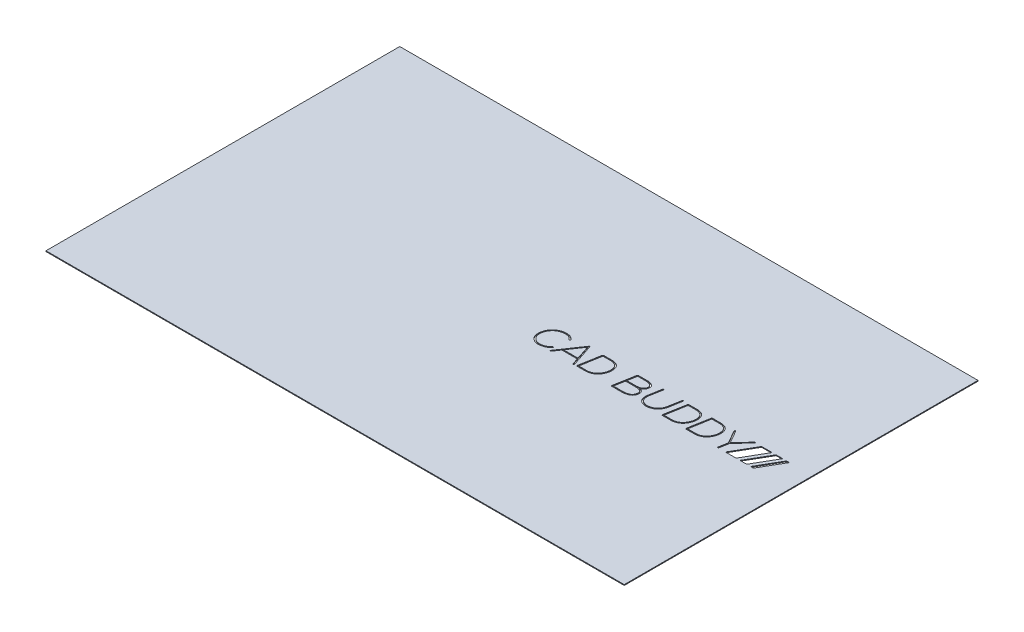
from build123d import *

# Parameters (mm, degrees)
SKETCH1_W           = 1030.522416643
SKETCH1_H           = 409.334235309
BOSS_EXTRUDE1_DEPTH = 2.54
CUT_EXTRUDE1_DEPTH  = 2.54


with BuildPart() as part:
    # Sketch1 → Boss-Extrude1 (new body)
    # profile 1 of 2: a face of its own
    with BuildSketch(Plane(origin=(0, 0, 0), x_dir=(1, 0, 0), z_dir=(0, 1, 0))):
        with Locations((439.348755368, 37.716505685)):
            Rectangle(SKETCH1_W, SKETCH1_H)
        Polygon((878.697510735, 75.43301137), (869.172510735, 75.43301137), (825.621241315, 0), (835.146241315, 0), align=None, mode=Mode.SUBTRACT)
        Polygon((821.547510735, 75.43301137), (777.996241315, 0), (743.071241315, 0), (786.622510735, 75.43301137), align=None, mode=Mode.SUBTRACT)
        Polygon((856.472510735, 75.43301137), (812.921241315, 0), (790.696241315, 0), (834.247510735, 75.43301137), align=None, mode=Mode.SUBTRACT)
    # profile 2 of 2: a face of its own
    with BuildSketch(Plane(origin=(0, 0, 0), x_dir=(1, 0, 0), z_dir=(0, 1, 0))):
        Polygon((-950.390036311, -544.981502598), (954.609963689, -544.981502598), (954.609963689, -166.950611969), (-75.912452954, -166.950611969), (-75.912452954, 242.38362334), (954.609963689, 242.38362334), (954.609963689, 620.414513968), (-950.390036311, 620.414513968), align=None)
    extrude(amount=BOSS_EXTRUDE1_DEPTH)

    # Sketch3 → Cut-Extrude1 (cut)
    # profile 1 of 8: a face of its own
    with BuildSketch(Plane(origin=(0, 2.54, 0), x_dir=(1, 0, 0), z_dir=(0, 1, 0))):
        with BuildLine():
            add(Edge.make_bspline(
                [(716.636620291, 2.243270089), (716.621022077, 1.905468599), (716.593763907, 1.315154195), (716.863305183, 0.515071012), (717.474198698, 0.012779762), (717.973277626, -0.006733088), (718.239527657, -0.017142857)],
                knots=[0, 0, 0, 0, 1.251005084, 2.186154716, 3.032344715, 4, 4, 4, 4], degree=3))
            add(Edge.make_bspline(
                [(718.239527657, -0.017142857), (718.490189121, 0.012230662), (719.018079174, 0.074090944), (719.750563496, 0.51682213), (720.38577985, 1.238901166), (720.562412186, 1.884208643), (720.656670514, 2.228571429)],
                knots=[0, 0, 0, 0, 0.842313664, 1.77390253, 2.812062229, 4, 4, 4, 4], degree=3))
            Line((720.656670514, 2.228571429), (725.763249755, 31.155636161))
            Line((725.763249755, 31.155636161), (764.999097969, 73.576238839))
            add(Edge.make_bspline(
                [(764.999097969, 73.576238839), (765.244884766, 73.862641095), (765.681277499, 74.371146291), (766.074464519, 75.193791072), (766.0898835, 75.981787228), (765.661809494, 76.568762835), (765.034149293, 76.956152137), (764.214130608, 76.940125235), (763.327309622, 76.591956196), (762.766676913, 76.176705724), (762.450956228, 75.942857143)],
                knots=[0, 0, 0, 0, 1.307658571, 2.321738624, 3.116123316, 3.903530844, 4.730968173, 5.584895801, 6.639932453, 8, 8, 8, 8], degree=3))
            Line((762.450956228, 75.942857143), (724.333863594, 34.473448661))
            Line((724.333863594, 34.473448661), (700.719611362, 75.946104911))
            add(Edge.make_bspline(
                [(700.719611362, 75.946104911), (700.487822454, 76.180059219), (700.067343928, 76.604465905), (699.277973236, 76.954797433), (698.463380944, 76.939421812), (697.756735661, 76.557575578), (697.166634268, 76.014683784), (696.891276908, 75.256274436), (696.942143315, 74.399062263), (697.189892226, 73.856442825), (697.325241942, 73.56)],
                knots=[0, 0, 0, 0, 1.181218228, 2.142798388, 3.030039168, 4.017166943, 4.979852749, 5.861078268, 6.831468325, 8, 8, 8, 8], degree=3))
            Line((697.325241942, 73.56), (721.734477434, 31.155636161))
            Line((721.734477434, 31.155636161), (716.636620291, 2.243270089))
        make_face()
    # profile 2 of 8: a face of its own
    with BuildSketch(Plane(origin=(0, 2.54, 0), x_dir=(1, 0, 0), z_dir=(0, 1, 0))):
        with BuildLine():
            add(Edge.make_bspline(
                [(640.88583346, 0.30359933), (641.842722985, 0.369851971), (643.736667725, 0.500983973), (646.525323889, 0.863769693), (649.22190943, 1.356618161), (651.812134214, 1.995790287), (654.310962107, 2.746460241), (656.706845669, 3.641019222), (659.013956052, 4.648086093), (661.215705386, 5.805248345), (663.320688632, 7.083112773), (665.316389088, 8.503389777), (667.235026432, 10.029350108), (669.035944189, 11.705690169), (670.755619681, 13.50259076), (672.354789306, 15.44451417), (673.889110265, 17.492753904), (675.733014147, 20.385806758), (677.784409253, 24.079143747), (679.796737798, 28.594313424), (681.346510948, 33.105001718), (682.381865404, 37.627651796), (682.935952512, 42.149310024), (683.0038995, 46.677509454), (682.59490101, 51.201947163), (681.834372882, 54.924856029), (681.009481486, 57.829851086), (680.217790963, 59.894900038), (679.278163293, 61.825391043), (678.201436812, 63.632577396), (676.995412987, 65.316233832), (675.605776072, 66.845765195), (674.091583347, 68.255589976), (672.449616506, 69.55061614), (670.638542865, 70.678611438), (668.70881834, 71.720832864), (666.603427832, 72.580949439), (664.370612873, 73.336575873), (661.995910167, 73.974824651), (659.475081119, 74.465389333), (656.812731076, 74.825322278), (654.989004251, 74.963596534), (654.056670514, 75.034285714)],
                knots=[0, 0, 0, 0, 0.999295175, 1.977877061, 2.928525191, 3.854231462, 4.756488502, 5.645743385, 6.517543425, 7.377798646, 8.235598142, 9.081452247, 9.928604735, 10.788179659, 11.643143241, 12.518352726, 13.407946438, 14.308079036, 16.091098334, 17.805063943, 19.452657269, 21.053083911, 22.630629005, 24.19085238, 25.763355152, 27.354996138, 28.142638538, 28.907860309, 29.656169272, 30.377113826, 31.097689454, 31.81024964, 32.526457578, 33.251839058, 33.985265051, 34.747073797, 35.534423556, 36.351625181, 37.202348423, 38.09450905, 39.025866443, 40, 40, 40, 40], degree=3))
            add(Edge.make_bspline(
                [(654.056670514, 75.034285714), (652.810956228, 75.034285714), (650.388099085, 75.034285714), (646.845241942, 75.034285714), (643.496670514, 75.034285714), (640.273813371, 75.034285714), (637.056670514, 75.034285714), (633.719527657, 75.034285714), (630.199527657, 75.034285714), (627.793813371, 75.034285714), (626.559527657, 75.034285714)],
                knots=[0, 0, 0, 0, 1.087281796, 2.114713217, 3.092269327, 4.009975062, 4.927680798, 5.900249377, 6.922693267, 8, 8, 8, 8], degree=3))
            add(Edge.make_bspline(
                [(626.559527657, 75.034285714), (626.122390391, 74.98936814), (625.253505794, 74.900086827), (624.116321367, 74.251931782), (623.213224985, 73.31755122), (622.975458552, 72.507539002), (622.856670514, 72.102857143)],
                knots=[0, 0, 0, 0, 1.025104092, 2.037568578, 3.019569853, 4, 4, 4, 4], degree=3))
            Line((622.856670514, 72.102857143), (610.734828996, 3.359179688))
            add(Edge.make_bspline(
                [(610.734828996, 3.359179688), (610.70653514, 3.147895225), (610.653517572, 2.75198637), (610.757048519, 2.175922834), (610.93684067, 1.644914036), (611.26990732, 1.188383686), (611.687185592, 0.809474861), (612.174206496, 0.502487668), (612.76072632, 0.334282345), (613.175690416, 0.306193353), (613.393813371, 0.291428571)],
                knots=[0, 0, 0, 0, 1.08844057, 2.039540695, 2.977861543, 3.947370317, 4.903444139, 5.865362813, 6.877942992, 8, 8, 8, 8], degree=3))
            add(Edge.make_bspline(
                [(613.393813371, 0.291428571), (614.6223848, 0.291428571), (617.0223848, 0.291428571), (620.536670514, 0.291428571), (623.873813371, 0.291428571), (627.090956228, 0.291428571), (630.313813371, 0.291428571), (633.6623848, 0.291428571), (637.205241942, 0.291428571), (639.628099085, 0.291428571), (640.873813371, 0.291428571)],
                knots=[0, 0, 0, 0, 1.072988147, 2.096069869, 3.069245165, 3.987523394, 4.905801622, 5.883967561, 6.912039925, 8, 8, 8, 8], degree=3))
            Line((640.873813371, 0.291428571), (640.88583346, 0.30359933))
        make_face()
        with BuildLine():
            add(Edge.make_bspline(
                [(626.663673862, 71.522159598), (627.863244115, 71.521242131), (630.205671249, 71.519450572), (633.628099126, 71.52013563), (636.873813361, 71.519966624), (639.999527659, 71.520008717), (643.136670513, 71.519997495), (646.399527657, 71.520000725), (649.856670514, 71.519999802), (652.2223848, 71.519999933), (653.439527657, 71.52)],
                knots=[0, 0, 0, 0, 1.07521098, 2.099588054, 3.067624389, 3.98444187, 4.901259351, 5.879539457, 6.909038416, 8, 8, 8, 8], degree=3))
            add(Edge.make_bspline(
                [(653.439527657, 71.52), (654.268877473, 71.453577186), (655.891802533, 71.323596753), (658.25687519, 71.000763752), (660.49068907, 70.558118708), (662.593108597, 69.991797465), (664.570074547, 69.305839649), (666.425952286, 68.506199309), (668.144451906, 67.570335098), (669.749764494, 66.548875642), (671.213607669, 65.38825481), (672.558477941, 64.121578211), (673.76114752, 62.71935748), (674.849395331, 61.210436461), (675.784496599, 59.571258057), (676.623027854, 57.830597557), (677.295932956, 55.958811984), (678.04456016, 53.335606005), (678.686878401, 49.965802785), (679.053535003, 45.876839092), (678.9915862, 41.783360149), (678.457402455, 37.696868846), (677.53722015, 33.608569235), (676.136517259, 29.533088236), (674.354687247, 25.441795923), (672.520991657, 22.094027862), (670.843838156, 19.49610778), (669.521488918, 17.614041657), (668.06271473, 15.890197469), (666.561201682, 14.244707268), (664.94386731, 12.740121926), (663.244650397, 11.346721903), (661.457165703, 10.075996703), (659.584947799, 8.923676331), (657.62157406, 7.897507678), (655.581951944, 6.966796469), (653.450923998, 6.161989555), (651.235236889, 5.475948853), (648.933771651, 4.911082018), (646.54155205, 4.464727433), (644.062662992, 4.142331108), (642.377366346, 4.009845093), (641.525241942, 3.942857143)],
                knots=[0, 0, 0, 0, 0.967011303, 1.892309911, 2.772922942, 3.612418362, 4.421183526, 5.203550084, 5.958449525, 6.693598579, 7.412513827, 8.126687773, 8.837797046, 9.556681607, 10.28583451, 11.028626024, 11.799859975, 12.594564328, 14.198191793, 15.778608685, 17.359723364, 18.946534416, 20.561129796, 22.222646425, 23.947881401, 25.743407272, 26.651766224, 27.542070986, 28.41465597, 29.274814831, 30.130112619, 30.979768914, 31.827605759, 32.677469744, 33.53318012, 34.401202405, 35.28204087, 36.179158533, 37.095833927, 38.035140818, 39.006522405, 40, 40, 40, 40], degree=3))
            add(Edge.make_bspline(
                [(641.525241942, 3.942857143), (640.308099085, 3.942857143), (637.9423848, 3.942857143), (634.485241942, 3.942857143), (631.2223848, 3.942857143), (628.085241942, 3.942857143), (624.959527657, 3.942857143), (621.713813371, 3.942857143), (618.290956228, 3.942857143), (615.948099085, 3.942857143), (614.748099085, 3.942857143)],
                knots=[0, 0, 0, 0, 1.090909091, 2.120358515, 3.098591549, 4.015364917, 4.932138284, 5.900128041, 6.924455826, 8, 8, 8, 8], degree=3))
            Line((614.748099085, 3.942857143), (626.663673862, 71.522159598))
        make_face(mode=Mode.SUBTRACT)
    # profile 3 of 8: a face of its own
    with BuildSketch(Plane(origin=(0, 2.54, 0), x_dir=(1, 0, 0), z_dir=(0, 1, 0))):
        with BuildLine():
            add(Edge.make_bspline(
                [(562.988690603, 0.30359933), (563.945580128, 0.369851971), (565.839524868, 0.500983973), (568.628181031, 0.863769693), (571.324766573, 1.356618161), (573.914991357, 1.995790287), (576.41381925, 2.746460241), (578.809702812, 3.641019222), (581.116813195, 4.648086093), (583.318562529, 5.805248345), (585.423545774, 7.083112773), (587.419246231, 8.503389777), (589.337883575, 10.029350108), (591.138801332, 11.705690169), (592.858476824, 13.50259076), (594.457646449, 15.44451417), (595.991967408, 17.492753904), (597.835871289, 20.385806758), (599.887266396, 24.079143747), (601.899594941, 28.594313424), (603.449368091, 33.105001718), (604.484722547, 37.627651796), (605.038809655, 42.149310024), (605.106756643, 46.677509454), (604.697758152, 51.201947163), (603.937230025, 54.924856029), (603.112338629, 57.829851086), (602.320648106, 59.894900038), (601.381020436, 61.825391043), (600.304293955, 63.632577396), (599.098270129, 65.316233832), (597.708633215, 66.845765195), (596.19444049, 68.255589976), (594.552473649, 69.55061614), (592.741400008, 70.678611438), (590.811675483, 71.720832864), (588.706284975, 72.580949439), (586.473470016, 73.336575873), (584.09876731, 73.974824651), (581.577938262, 74.465389333), (578.915588218, 74.825322278), (577.091861394, 74.963596534), (576.159527657, 75.034285714)],
                knots=[0, 0, 0, 0, 0.999295175, 1.977877061, 2.928525191, 3.854231462, 4.756488502, 5.645743385, 6.517543425, 7.377798646, 8.235598142, 9.081452247, 9.928604735, 10.788179659, 11.643143241, 12.518352726, 13.407946438, 14.308079036, 16.091098334, 17.805063943, 19.452657269, 21.053083911, 22.630629005, 24.19085238, 25.763355152, 27.354996138, 28.142638538, 28.907860309, 29.656169272, 30.377113826, 31.097689454, 31.81024964, 32.526457578, 33.251839058, 33.985265051, 34.747073797, 35.534423556, 36.351625181, 37.202348423, 38.09450905, 39.025866443, 40, 40, 40, 40], degree=3))
            add(Edge.make_bspline(
                [(576.159527657, 75.034285714), (574.913813371, 75.034285714), (572.490956228, 75.034285714), (568.948099085, 75.034285714), (565.599527657, 75.034285714), (562.376670514, 75.034285714), (559.159527657, 75.034285714), (555.8223848, 75.034285714), (552.3023848, 75.034285714), (549.896670514, 75.034285714), (548.6623848, 75.034285714)],
                knots=[0, 0, 0, 0, 1.087281796, 2.114713217, 3.092269327, 4.009975062, 4.927680798, 5.900249377, 6.922693267, 8, 8, 8, 8], degree=3))
            add(Edge.make_bspline(
                [(548.6623848, 75.034285714), (548.225247534, 74.98936814), (547.356362937, 74.900086827), (546.21917851, 74.251931782), (545.316082128, 73.31755122), (545.078315695, 72.507539002), (544.959527657, 72.102857143)],
                knots=[0, 0, 0, 0, 1.025104092, 2.037568578, 3.019569853, 4, 4, 4, 4], degree=3))
            Line((544.959527657, 72.102857143), (532.837686139, 3.359179688))
            add(Edge.make_bspline(
                [(532.837686139, 3.359179688), (532.809392283, 3.147895225), (532.756374715, 2.75198637), (532.859905661, 2.175922834), (533.039697813, 1.644914036), (533.372764462, 1.188383686), (533.790042735, 0.809474861), (534.277063639, 0.502487668), (534.863583463, 0.334282345), (535.278547559, 0.306193353), (535.496670514, 0.291428571)],
                knots=[0, 0, 0, 0, 1.08844057, 2.039540695, 2.977861543, 3.947370317, 4.903444139, 5.865362813, 6.877942992, 8, 8, 8, 8], degree=3))
            add(Edge.make_bspline(
                [(535.496670514, 0.291428571), (536.725241942, 0.291428571), (539.125241942, 0.291428571), (542.639527657, 0.291428571), (545.976670514, 0.291428571), (549.193813371, 0.291428571), (552.416670514, 0.291428571), (555.765241942, 0.291428571), (559.308099085, 0.291428571), (561.730956228, 0.291428571), (562.976670514, 0.291428571)],
                knots=[0, 0, 0, 0, 1.072988147, 2.096069869, 3.069245165, 3.987523394, 4.905801622, 5.883967561, 6.912039925, 8, 8, 8, 8], degree=3))
            Line((562.976670514, 0.291428571), (562.988690603, 0.30359933))
        make_face()
        with BuildLine():
            add(Edge.make_bspline(
                [(548.766531005, 71.522159598), (549.966101258, 71.521242131), (552.308528392, 71.519450572), (555.730956269, 71.52013563), (558.976670504, 71.519966624), (562.102384802, 71.520008717), (565.239527656, 71.519997495), (568.5023848, 71.520000725), (571.959527657, 71.519999802), (574.325241942, 71.519999933), (575.5423848, 71.52)],
                knots=[0, 0, 0, 0, 1.07521098, 2.099588054, 3.067624389, 3.98444187, 4.901259351, 5.879539457, 6.909038416, 8, 8, 8, 8], degree=3))
            add(Edge.make_bspline(
                [(575.5423848, 71.52), (576.371734616, 71.453577186), (577.994659676, 71.323596753), (580.359732332, 71.000763752), (582.593546212, 70.558118708), (584.69596574, 69.991797465), (586.67293169, 69.305839649), (588.528809429, 68.506199309), (590.247309049, 67.570335098), (591.852621637, 66.548875642), (593.316464812, 65.38825481), (594.661335084, 64.121578211), (595.864004663, 62.71935748), (596.952252474, 61.210436461), (597.887353742, 59.571258057), (598.725884997, 57.830597557), (599.398790099, 55.958811984), (600.147417303, 53.335606005), (600.789735544, 49.965802785), (601.156392146, 45.876839092), (601.094443343, 41.783360149), (600.560259598, 37.696868846), (599.640077292, 33.608569235), (598.239374402, 29.533088236), (596.457544389, 25.441795923), (594.6238488, 22.094027862), (592.946695299, 19.49610778), (591.624346061, 17.614041657), (590.165571872, 15.890197469), (588.664058825, 14.244707268), (587.046724452, 12.740121926), (585.34750754, 11.346721903), (583.560022846, 10.075996703), (581.687804942, 8.923676331), (579.724431203, 7.897507678), (577.684809086, 6.966796469), (575.553781141, 6.161989555), (573.338094032, 5.475948853), (571.036628794, 4.911082018), (568.644409192, 4.464727433), (566.165520135, 4.142331108), (564.480223489, 4.009845093), (563.628099085, 3.942857143)],
                knots=[0, 0, 0, 0, 0.967011303, 1.892309911, 2.772922942, 3.612418362, 4.421183526, 5.203550084, 5.958449525, 6.693598579, 7.412513827, 8.126687773, 8.837797046, 9.556681607, 10.28583451, 11.028626024, 11.799859975, 12.594564328, 14.198191793, 15.778608685, 17.359723364, 18.946534416, 20.561129796, 22.222646425, 23.947881401, 25.743407272, 26.651766224, 27.542070986, 28.41465597, 29.274814831, 30.130112619, 30.979768914, 31.827605759, 32.677469744, 33.53318012, 34.401202405, 35.28204087, 36.179158533, 37.095833927, 38.035140818, 39.006522405, 40, 40, 40, 40], degree=3))
            add(Edge.make_bspline(
                [(563.628099085, 3.942857143), (562.410956228, 3.942857143), (560.045241942, 3.942857143), (556.588099085, 3.942857143), (553.325241942, 3.942857143), (550.188099085, 3.942857143), (547.0623848, 3.942857143), (543.816670514, 3.942857143), (540.393813371, 3.942857143), (538.050956228, 3.942857143), (536.850956228, 3.942857143)],
                knots=[0, 0, 0, 0, 1.090909091, 2.120358515, 3.098591549, 4.015364917, 4.932138284, 5.900128041, 6.924455826, 8, 8, 8, 8], degree=3))
            Line((536.850956228, 3.942857143), (548.766531005, 71.522159598))
        make_face(mode=Mode.SUBTRACT)
    # profile 4 of 8: a face of its own
    with BuildSketch(Plane(origin=(0, 2.54, 0), x_dir=(1, 0, 0), z_dir=(0, 1, 0))):
        with BuildLine():
            add(Edge.make_bspline(
                [(517.30692721, 33.720652902), (517.104105367, 32.901023975), (516.704551372, 31.28637534), (515.973086569, 28.94041609), (515.195516252, 26.684079985), (514.303334595, 24.54517217), (513.318304826, 22.511390134), (512.260963494, 20.572934615), (511.111137706, 18.744972681), (509.895353804, 17.005318489), (508.544088953, 15.408395078), (507.151294004, 13.872072092), (505.648508651, 12.46496889), (504.069052664, 11.158586268), (502.399525137, 9.951775081), (500.639906065, 8.859655007), (498.786519264, 7.876769584), (496.245870081, 6.710974426), (493.031200316, 5.523184343), (489.187257939, 4.448356777), (485.404011032, 3.831617132), (481.691148449, 3.615873862), (478.055878523, 3.821072506), (474.486093066, 4.439785851), (470.999481738, 5.501214589), (468.175924153, 6.69287276), (466.040179004, 7.875071574), (464.531510477, 8.849693832), (463.160898467, 9.954280333), (461.901769978, 11.151384611), (460.784170221, 12.466808256), (459.779446131, 13.880119875), (458.912965656, 15.407180054), (458.153525319, 17.028126367), (457.511892541, 18.751117294), (457.024183979, 20.590477315), (456.648574109, 22.526641688), (456.391011723, 24.565292251), (456.258957341, 26.706448909), (456.239677774, 28.955735344), (456.363691057, 31.307584615), (456.534832303, 32.903540397), (456.6223848, 33.72)],
                knots=[0, 0, 0, 0, 1.052607355, 2.073610355, 3.062893337, 4.027544296, 4.961279858, 5.879664996, 6.779199292, 7.653053879, 8.523386429, 9.385660849, 10.237509641, 11.087777591, 11.940103041, 12.804142008, 13.667975297, 14.554290253, 16.288073003, 17.935380479, 19.523786526, 21.058102051, 22.563961658, 24.054010431, 25.564330607, 27.099638489, 27.865065386, 28.606161103, 29.336144068, 30.056782474, 30.769344261, 31.48499867, 32.215885209, 32.955403614, 33.715138288, 34.505046732, 35.325318782, 36.172865581, 37.065345485, 37.998781952, 38.976216188, 40, 40, 40, 40], degree=3))
            add(Edge.make_bspline(
                [(456.6223848, 33.72), (457.241626142, 37.199630033), (458.463637605, 44.066335306), (460.252946102, 54.333090476), (462.071732005, 64.594655459), (463.290889612, 71.468583637), (463.908099085, 74.948571429)],
                knots=[0, 0, 0, 0, 1.01299813, 1.999051489, 2.98700187, 4, 4, 4, 4], degree=3))
            add(Edge.make_bspline(
                [(463.908099085, 74.948571429), (463.914023557, 75.23668037), (463.92465687, 75.753781697), (463.627818028, 76.444468823), (463.048348522, 76.84847536), (462.338837158, 76.952452934), (461.596642761, 76.87092391), (460.932714907, 76.495651764), (460.412226467, 75.87887826), (460.233039611, 75.351956841), (460.136670514, 75.068571429)],
                knots=[0, 0, 0, 0, 1.142497997, 2.050568878, 2.86724363, 3.842442552, 4.855323895, 5.794653566, 6.813935082, 8, 8, 8, 8], degree=3))
            add(Edge.make_bspline(
                [(460.136670514, 75.068571429), (459.521884136, 71.565297632), (458.309189601, 64.654928201), (456.459858749, 54.357756879), (454.678248413, 44.071489605), (453.453792889, 37.199499894), (452.833813371, 33.72)],
                knots=[0, 0, 0, 0, 1.016507693, 2.005108393, 2.989924981, 4, 4, 4, 4], degree=3))
            add(Edge.make_bspline(
                [(452.833813371, 33.72), (452.731004282, 32.795162967), (452.530835885, 30.994513345), (452.427055502, 28.338406932), (452.406145618, 25.803071916), (452.575347569, 23.377620326), (452.829449376, 21.066076305), (453.266630702, 18.879312493), (453.826701621, 16.80650228), (454.547933317, 14.860414654), (455.393639339, 13.024886411), (456.367038913, 11.300860956), (457.505839784, 9.704386806), (458.778891975, 8.223191742), (460.190555414, 6.862235346), (461.746918654, 5.627832539), (463.422640245, 4.487023818), (465.851141435, 3.183480941), (469.017546239, 1.824395678), (472.942653895, 0.625099626), (476.960843792, -0.0784155), (481.05688844, -0.323340972), (485.241592835, -0.065932019), (489.506288486, 0.637830065), (493.846009939, 1.845542179), (497.462860174, 3.200853515), (500.342648425, 4.490953656), (502.412978899, 5.639024418), (504.407923492, 6.858932652), (506.284185123, 8.228557766), (508.069519795, 9.706081922), (509.771582937, 11.291737837), (511.342669136, 13.02286347), (512.852099487, 14.838122), (514.226654938, 16.800996069), (515.539633364, 18.857961826), (516.742934073, 21.044796095), (517.832713729, 23.355649507), (518.828008374, 25.783864188), (519.734337462, 28.316913163), (520.550727684, 30.969028931), (520.991957401, 32.791723211), (521.216670514, 33.72)],
                knots=[0, 0, 0, 0, 1.027716656, 2.00095535, 2.935310908, 3.8272855, 4.685534274, 5.502699192, 6.288408952, 7.055405902, 7.792647579, 8.519325572, 9.239281043, 9.95554562, 10.674393041, 11.402030237, 12.147951809, 12.910780266, 14.44353951, 15.947423231, 17.434784648, 18.939926711, 20.470278768, 22.057207608, 23.706696919, 25.438693343, 26.320127344, 27.19027503, 28.052207839, 28.902079838, 29.754059601, 30.61158826, 31.469442207, 32.335181496, 33.218061287, 34.114804281, 35.030307274, 35.973514853, 36.936046979, 37.928507391, 38.945013144, 40, 40, 40, 40], degree=3))
            add(Edge.make_bspline(
                [(521.216670514, 33.72), (521.82697633, 37.200197901), (523.03266466, 44.075495301), (524.855337799, 54.353512673), (526.667422623, 64.657262173), (527.885023477, 71.565752821), (528.5023848, 75.068571429)],
                knots=[0, 0, 0, 0, 1.009863234, 1.995033118, 2.983419728, 4, 4, 4, 4], degree=3))
            add(Edge.make_bspline(
                [(528.5023848, 75.068571429), (528.501424762, 75.345293833), (528.499707058, 75.840406995), (528.196936434, 76.514049116), (527.588181578, 76.88015688), (526.853885438, 76.952192172), (526.093240082, 76.835077827), (525.400737536, 76.444401392), (524.870301554, 75.791291491), (524.679191408, 75.242806036), (524.576670514, 74.948571429)],
                knots=[0, 0, 0, 0, 1.079918528, 1.932195832, 2.759330193, 3.7327556, 4.779583398, 5.733447023, 6.784109368, 8, 8, 8, 8], degree=3))
            add(Edge.make_bspline(
                [(524.576670514, 74.948571429), (523.959461041, 71.468583637), (522.740303434, 64.594655459), (520.921517531, 54.333090476), (519.132209033, 44.066335306), (517.91019757, 37.199630033), (517.290956228, 33.72)],
                knots=[0, 0, 0, 0, 1.01299813, 2.000948511, 2.98700187, 4, 4, 4, 4], degree=3))
            Line((517.290956228, 33.72), (517.30692721, 33.720652902))
        make_face()
    # profile 5 of 8: a face of its own
    with BuildSketch(Plane(origin=(0, 2.54, 0), x_dir=(1, 0, 0), z_dir=(0, 1, 0))):
        with BuildLine():
            add(Edge.make_bspline(
                [(434.430102434, 21.457633929), (434.518595858, 22.11544764), (434.690228249, 23.391272844), (434.758405189, 25.269298229), (434.664321321, 27.038949632), (434.384324482, 28.697893125), (433.965377488, 30.250602725), (433.356915045, 31.690228489), (432.584083134, 33.015102564), (431.647165607, 34.222335234), (430.573490056, 35.319977988), (429.40000439, 36.328151278), (428.113340209, 37.224382856), (426.733391193, 38.034822151), (425.251627123, 38.754192309), (423.652179884, 39.351025694), (421.964853113, 39.869802217), (420.790284257, 40.122900112), (420.193813371, 40.251428571)],
                knots=[0, 0, 0, 0, 1.194510597, 2.316745149, 3.378288509, 4.379638158, 5.340691787, 6.267484065, 7.185093137, 8.09470723, 9.011508395, 9.945582237, 10.876136187, 11.830779774, 12.824754949, 13.837509919, 14.901841839, 16, 16, 16, 16], degree=3))
            add(Edge.make_bspline(
                [(420.193813371, 40.251428571), (421.16461254, 40.567593104), (423.057812838, 41.184160161), (425.651909806, 42.534136598), (427.99466983, 44.095858447), (430.017991843, 45.960062521), (431.750059466, 48.05053295), (433.112752803, 50.38917716), (434.167162409, 52.92491272), (434.563759868, 54.729125916), (434.765241942, 55.645714286)],
                knots=[0, 0, 0, 0, 1.092874696, 2.131265421, 3.123581607, 4.103547946, 5.069939407, 6.022897384, 6.995579199, 8, 8, 8, 8], degree=3))
            add(Edge.make_bspline(
                [(434.765241942, 55.645714286), (434.840826499, 56.57652824), (434.985091846, 58.353137162), (434.812296608, 60.926746849), (434.326985412, 63.258691636), (433.510314854, 65.35667543), (432.387036407, 67.225098346), (430.923296281, 68.839072866), (429.132943869, 70.196598148), (427.065308702, 71.271920918), (424.869944172, 72.157874016), (422.663474957, 72.957332946), (420.473672671, 73.62758933), (418.293166216, 74.160922045), (416.129492895, 74.557313698), (413.977040865, 74.816377973), (411.840959042, 74.938206522), (410.422488271, 74.922212148), (409.719527657, 74.914285714)],
                knots=[0, 0, 0, 0, 1.221510875, 2.331450994, 3.364637024, 4.328955469, 5.265737717, 6.203445891, 7.164245285, 8.191998032, 9.245309294, 10.263044025, 11.264278728, 12.242460943, 13.200838971, 14.142866002, 15.07964825, 16, 16, 16, 16], degree=3))
            Line((409.719527657, 74.914285714), (381.057005335, 74.93030692))
            add(Edge.make_bspline(
                [(381.057005335, 74.93030692), (380.747548989, 74.882488765), (380.159776345, 74.791664312), (379.400193854, 74.334664028), (378.831710616, 73.658318779), (378.638757587, 73.100724681), (378.536670514, 72.805714286)],
                knots=[0, 0, 0, 0, 1.056677754, 2.007023881, 2.94556152, 4, 4, 4, 4], degree=3))
            add(Edge.make_bspline(
                [(378.536670514, 72.805714286), (376.469729467, 61.051141183), (372.336650178, 37.546560494), (368.184013915, 14.045427121), (366.108099085, 2.297142857)],
                knots=[0, 0, 0, 0, 1.000194239, 2, 2, 2, 2], degree=3))
            add(Edge.make_bspline(
                [(366.108099085, 2.297142857), (366.100941903, 2.008117549), (366.087905493, 1.481674034), (366.422569895, 0.759918025), (367.070733764, 0.30359893), (367.59232294, 0.217756097), (367.873813371, 0.171428571)],
                knots=[0, 0, 0, 0, 1.09536942, 1.995154444, 2.918028084, 4, 4, 4, 4], degree=3))
            add(Edge.make_bspline(
                [(367.873813371, 0.171428571), (373.325241942, 0.171428571), (384.2223848, 0.171428571), (395.119527657, 0.171428571), (400.565241942, 0.171428571)],
                knots=[0, 0, 0, 0, 1.000524384, 2, 2, 2, 2], degree=3))
            add(Edge.make_bspline(
                [(400.565241942, 0.171428571), (401.508348512, 0.165996616), (403.379159679, 0.155221415), (406.166513192, 0.33549345), (408.90860957, 0.656429647), (411.597102753, 1.140285733), (414.237228975, 1.75692582), (416.829683038, 2.531623853), (419.379061412, 3.453708434), (421.862405369, 4.526191854), (424.23184258, 5.76270585), (426.382732453, 7.295834927), (428.306732736, 9.063268898), (430.003725473, 11.074998531), (431.466331371, 13.322587437), (432.7048094, 15.805834057), (433.701016758, 18.535754999), (434.177464615, 20.457719634), (434.4223848, 21.445714286)],
                knots=[0, 0, 0, 0, 1.033463853, 2.050050099, 3.059219513, 4.058073865, 5.042528709, 6.029391436, 7.022021109, 8.012217305, 8.992979244, 9.945330778, 10.898361732, 11.849476713, 12.822306886, 13.830679098, 14.884850736, 16, 16, 16, 16], degree=3))
            Line((434.4223848, 21.445714286), (434.430102434, 21.457633929))
        make_face()
        with BuildLine():
            add(Edge.make_bspline(
                [(409.110738594, 71.404637277), (410.269955397, 71.378055736), (412.639077529, 71.323730337), (416.255400805, 70.729703147), (419.972517047, 69.694953002), (423.095480578, 68.555976779), (425.517272572, 67.417601505), (427.059952393, 66.275104892), (428.362180166, 64.975387576), (429.384509094, 63.470545628), (430.108566776, 61.767641281), (430.572330866, 59.888349991), (430.75882262, 57.818877662), (430.665248563, 56.388355668), (430.616670514, 55.645714286)],
                knots=[0, 0, 0, 0, 1.363647557, 2.786922688, 4.299584316, 5.900146588, 6.697326205, 7.438656847, 8.147379583, 8.854472444, 9.565489818, 10.314320341, 11.124896034, 12, 12, 12, 12], degree=3))
            add(Edge.make_bspline(
                [(430.616670514, 55.645714286), (430.457540527, 54.996529876), (430.145957428, 53.725399934), (429.481378894, 51.919283539), (428.628477116, 50.271617565), (427.622711205, 48.769602661), (426.417404828, 47.437923872), (425.058209869, 46.246150219), (423.522228665, 45.216427686), (421.828260707, 44.348179944), (420.028124877, 43.607059597), (418.140250256, 42.974935639), (416.188384653, 42.41406424), (414.149852983, 42.005375756), (412.048848498, 41.644939699), (409.871899464, 41.435250441), (407.623972393, 41.308441681), (406.102566586, 41.312319171), (405.330956228, 41.314285714)],
                knots=[0, 0, 0, 0, 1.008756292, 1.975186567, 2.897471246, 3.804453989, 4.696540017, 5.601550699, 6.52766155, 7.480867571, 8.47111505, 9.464290153, 10.485916046, 11.535079697, 12.601765216, 13.703266585, 14.835167263, 16, 16, 16, 16], degree=3))
            Line((405.330956228, 41.314285714), (377.026508684, 41.31890625))
            Line((377.026508684, 41.31890625), (382.331251987, 71.404637277))
            Line((382.331251987, 71.404637277), (409.110738594, 71.404637277))
        make_face(mode=Mode.SUBTRACT)
        with BuildLine():
            Line((404.683311139, 37.558191964), (410.963456228, 37.558191964))
            add(Edge.make_bspline(
                [(410.963456228, 37.558191964), (411.732118657, 37.551670746), (413.228997504, 37.538971447), (415.416093902, 37.353240531), (417.488110762, 37.100864938), (419.430860979, 36.67467812), (421.261051692, 36.174517253), (422.962320219, 35.517235839), (424.546147287, 34.744346958), (426.007983854, 33.863823886), (427.303267221, 32.841953219), (428.392899585, 31.653941304), (429.247869858, 30.310533221), (429.896967583, 28.818448019), (430.315786372, 27.180762271), (430.538186334, 25.395976942), (430.535787022, 23.461088574), (430.363520437, 22.135834512), (430.273813371, 21.445714286)],
                knots=[0, 0, 0, 0, 1.245893496, 2.426229708, 3.557090794, 4.627424348, 5.64812322, 6.630639106, 7.579553193, 8.502788929, 9.392692682, 10.245302395, 11.103732037, 11.96266155, 12.872833628, 13.834731448, 14.872445921, 16, 16, 16, 16], degree=3))
            add(Edge.make_bspline(
                [(430.273813371, 21.445714286), (430.059560141, 20.596019964), (429.642807031, 18.943243241), (428.795085991, 16.590654183), (427.702675364, 14.47951207), (426.449509315, 12.561378801), (424.977236071, 10.88158591), (423.339454949, 9.376042442), (421.475268579, 8.130640457), (419.4417812, 7.110717088), (417.305066215, 6.277263997), (415.122158404, 5.53014343), (412.894033973, 4.918960339), (410.630333282, 4.412569147), (408.325912453, 4.06585105), (405.988481893, 3.795796964), (403.606409189, 3.679099594), (402.005295738, 3.694903667), (401.199527657, 3.702857143)],
                knots=[0, 0, 0, 0, 1.124995685, 2.188277165, 3.202361121, 4.17112113, 5.123060136, 6.063389002, 7.019955124, 7.991351748, 8.979265373, 9.963164682, 10.953011363, 11.944733039, 12.940031819, 13.944056732, 14.965336616, 16, 16, 16, 16], degree=3))
            add(Edge.make_bspline(
                [(401.199527657, 3.702857143), (396.050956228, 3.702857143), (385.7823848, 3.702857143), (375.513813371, 3.702857143), (370.393813371, 3.702857143)],
                knots=[0, 0, 0, 0, 1.002782415, 2, 2, 2, 2], degree=3))
            Line((370.393813371, 3.702857143), (376.363411585, 37.558191964))
            Line((376.363411585, 37.558191964), (404.683311139, 37.558191964))
        make_face(mode=Mode.SUBTRACT)
    # profile 6 of 8: a face of its own
    with BuildSketch(Plane(origin=(0, 2.54, 0), x_dir=(1, 0, 0), z_dir=(0, 1, 0))):
        with BuildLine():
            add(Edge.make_bspline(
                [(282.120119175, 0.30359933), (283.077008699, 0.369851971), (284.970953439, 0.500983973), (287.759609603, 0.863769693), (290.456195144, 1.356618161), (293.046419928, 1.995790287), (295.545247821, 2.746460241), (297.941131384, 3.641019222), (300.248241767, 4.648086093), (302.4499911, 5.805248345), (304.554974346, 7.083112773), (306.550674802, 8.503389777), (308.469312146, 10.029350108), (310.270229903, 11.705690169), (311.989905395, 13.50259076), (313.58907502, 15.44451417), (315.123395979, 17.492753904), (316.967299861, 20.385806758), (319.018694967, 24.079143747), (321.031023512, 28.594313424), (322.580796662, 33.105001718), (323.616151118, 37.627651796), (324.170238227, 42.149310024), (324.238185214, 46.677509454), (323.829186724, 51.201947163), (323.068658596, 54.924856029), (322.2437672, 57.829851086), (321.452076677, 59.894900038), (320.512449007, 61.825391043), (319.435722527, 63.632577396), (318.229698701, 65.316233832), (316.840061787, 66.845765195), (315.325869061, 68.255589976), (313.68390222, 69.55061614), (311.872828579, 70.678611438), (309.943104054, 71.720832864), (307.837713547, 72.580949439), (305.604898587, 73.336575873), (303.230195881, 73.974824651), (300.709366833, 74.465389333), (298.04701679, 74.825322278), (296.223289966, 74.963596534), (295.290956228, 75.034285714)],
                knots=[0, 0, 0, 0, 0.999295175, 1.977877061, 2.928525191, 3.854231462, 4.756488502, 5.645743385, 6.517543425, 7.377798646, 8.235598142, 9.081452247, 9.928604735, 10.788179659, 11.643143241, 12.518352726, 13.407946438, 14.308079036, 16.091098334, 17.805063943, 19.452657269, 21.053083911, 22.630629005, 24.19085238, 25.763355152, 27.354996138, 28.142638538, 28.907860309, 29.656169272, 30.377113826, 31.097689454, 31.81024964, 32.526457578, 33.251839058, 33.985265051, 34.747073797, 35.534423556, 36.351625181, 37.202348423, 38.09450905, 39.025866443, 40, 40, 40, 40], degree=3))
            add(Edge.make_bspline(
                [(295.290956228, 75.034285714), (294.045241942, 75.034285714), (291.6223848, 75.034285714), (288.079527657, 75.034285714), (284.730956228, 75.034285714), (281.508099085, 75.034285714), (278.290956228, 75.034285714), (274.953813371, 75.034285714), (271.433813371, 75.034285714), (269.028099085, 75.034285714), (267.793813371, 75.034285714)],
                knots=[0, 0, 0, 0, 1.087281796, 2.114713217, 3.092269327, 4.009975062, 4.927680798, 5.900249377, 6.922693267, 8, 8, 8, 8], degree=3))
            add(Edge.make_bspline(
                [(267.793813371, 75.034285714), (267.356676106, 74.98936814), (266.487791509, 74.900086827), (265.350607081, 74.251931782), (264.4475107, 73.31755122), (264.209744267, 72.507539002), (264.090956228, 72.102857143)],
                knots=[0, 0, 0, 0, 1.025104092, 2.037568578, 3.019569853, 4, 4, 4, 4], degree=3))
            Line((264.090956228, 72.102857143), (251.96911471, 3.359179688))
            add(Edge.make_bspline(
                [(251.96911471, 3.359179688), (251.940820854, 3.147895225), (251.887803287, 2.75198637), (251.991334233, 2.175922834), (252.171126384, 1.644914036), (252.504193034, 1.188383686), (252.921471307, 0.809474861), (253.40849221, 0.502487668), (253.995012034, 0.334282345), (254.40997613, 0.306193353), (254.628099085, 0.291428571)],
                knots=[0, 0, 0, 0, 1.08844057, 2.039540695, 2.977861543, 3.947370317, 4.903444139, 5.865362813, 6.877942992, 8, 8, 8, 8], degree=3))
            add(Edge.make_bspline(
                [(254.628099085, 0.291428571), (255.856670514, 0.291428571), (258.256670514, 0.291428571), (261.770956228, 0.291428571), (265.108099085, 0.291428571), (268.325241942, 0.291428571), (271.548099085, 0.291428571), (274.896670514, 0.291428571), (278.439527657, 0.291428571), (280.8623848, 0.291428571), (282.108099085, 0.291428571)],
                knots=[0, 0, 0, 0, 1.072988147, 2.096069869, 3.069245165, 3.987523394, 4.905801622, 5.883967561, 6.912039925, 8, 8, 8, 8], degree=3))
            Line((282.108099085, 0.291428571), (282.120119175, 0.30359933))
        make_face()
        with BuildLine():
            add(Edge.make_bspline(
                [(267.897959576, 71.522159598), (269.09752983, 71.521242131), (271.439956963, 71.519450572), (274.86238484, 71.52013563), (278.108099075, 71.519966624), (281.233813374, 71.520008717), (284.370956227, 71.519997495), (287.633813371, 71.520000725), (291.090956228, 71.519999802), (293.456670514, 71.519999933), (294.673813371, 71.52)],
                knots=[0, 0, 0, 0, 1.07521098, 2.099588054, 3.067624389, 3.98444187, 4.901259351, 5.879539457, 6.909038416, 8, 8, 8, 8], degree=3))
            add(Edge.make_bspline(
                [(294.673813371, 71.52), (295.503163187, 71.453577186), (297.126088248, 71.323596753), (299.491160904, 71.000763752), (301.724974784, 70.558118708), (303.827394312, 69.991797465), (305.804360261, 69.305839649), (307.660238, 68.506199309), (309.37873762, 67.570335098), (310.984050209, 66.548875642), (312.447893383, 65.38825481), (313.792763655, 64.121578211), (314.995433234, 62.71935748), (316.083681045, 61.210436461), (317.018782313, 59.571258057), (317.857313568, 57.830597557), (318.53021867, 55.958811984), (319.278845874, 53.335606005), (319.921164116, 49.965802785), (320.287820717, 45.876839092), (320.225871915, 41.783360149), (319.691688169, 37.696868846), (318.771505864, 33.608569235), (317.370802973, 29.533088236), (315.588972961, 25.441795923), (313.755277372, 22.094027862), (312.078123871, 19.49610778), (310.755774632, 17.614041657), (309.297000444, 15.890197469), (307.795487396, 14.244707268), (306.178153024, 12.740121926), (304.478936111, 11.346721903), (302.691451417, 10.075996703), (300.819233514, 8.923676331), (298.855859775, 7.897507678), (296.816237658, 6.966796469), (294.685209713, 6.161989555), (292.469522603, 5.475948853), (290.168057365, 4.911082018), (287.775837764, 4.464727433), (285.296948706, 4.142331108), (283.611652061, 4.009845093), (282.759527657, 3.942857143)],
                knots=[0, 0, 0, 0, 0.967011303, 1.892309911, 2.772922942, 3.612418362, 4.421183526, 5.203550084, 5.958449525, 6.693598579, 7.412513827, 8.126687773, 8.837797046, 9.556681607, 10.28583451, 11.028626024, 11.799859975, 12.594564328, 14.198191793, 15.778608685, 17.359723364, 18.946534416, 20.561129796, 22.222646425, 23.947881401, 25.743407272, 26.651766224, 27.542070986, 28.41465597, 29.274814831, 30.130112619, 30.979768914, 31.827605759, 32.677469744, 33.53318012, 34.401202405, 35.28204087, 36.179158533, 37.095833927, 38.035140818, 39.006522405, 40, 40, 40, 40], degree=3))
            add(Edge.make_bspline(
                [(282.759527657, 3.942857143), (281.5423848, 3.942857143), (279.176670514, 3.942857143), (275.719527657, 3.942857143), (272.456670514, 3.942857143), (269.319527657, 3.942857143), (266.193813371, 3.942857143), (262.948099085, 3.942857143), (259.525241942, 3.942857143), (257.1823848, 3.942857143), (255.9823848, 3.942857143)],
                knots=[0, 0, 0, 0, 1.090909091, 2.120358515, 3.098591549, 4.015364917, 4.932138284, 5.900128041, 6.924455826, 8, 8, 8, 8], degree=3))
            Line((255.9823848, 3.942857143), (267.897959576, 71.522159598))
        make_face(mode=Mode.SUBTRACT)
    # profile 7 of 8: a face of its own
    with BuildSketch(Plane(origin=(0, 2.54, 0), x_dir=(1, 0, 0), z_dir=(0, 1, 0))):
        with BuildLine():
            Line((233.502289934, 21.393448661), (240.35082788, 0.423967634))
            add(Edge.make_bspline(
                [(240.35082788, 0.423967634), (240.486051261, 0.192954906), (240.73396259, -0.230571498), (241.363485195, -0.622342474), (242.100527588, -0.658685229), (242.83872772, -0.398974857), (243.53668978, 0.026862514), (244.005733891, 0.684560679), (244.230379478, 1.474653951), (244.158100336, 2.022122304), (244.119527657, 2.314285714)],
                knots=[0, 0, 0, 0, 1.027943766, 1.884577235, 2.752924428, 3.7991419, 4.888965506, 5.874793496, 6.86585667, 8, 8, 8, 8], degree=3))
            Line((244.119527657, 2.314285714), (219.420085692, 76.604966518))
            add(Edge.make_bspline(
                [(219.420085692, 76.604966518), (219.345424757, 76.758780842), (219.203701435, 77.050755176), (218.890252012, 77.433544627), (218.431372112, 77.615021199), (218.109104288, 77.642781541), (217.9423848, 77.657142857)],
                knots=[0, 0, 0, 0, 1.056175588, 2.004859858, 2.967849975, 4, 4, 4, 4], degree=3))
            add(Edge.make_bspline(
                [(217.9423848, 77.657142857), (217.758064351, 77.642632539), (217.391114911, 77.613745059), (216.854221813, 77.416939867), (216.372579796, 77.064606934), (216.107790092, 76.754524991), (215.970956228, 76.594285714)],
                knots=[0, 0, 0, 0, 0.952646594, 1.896551015, 2.913012671, 4, 4, 4, 4], degree=3))
            Line((215.970956228, 76.594285714), (165.204828996, 2.319508929))
            add(Edge.make_bspline(
                [(165.204828996, 2.319508929), (165.059853879, 2.033897105), (164.802652265, 1.52719069), (164.724688889, 0.723091585), (164.980487894, 0.036528971), (165.541947331, -0.41556448), (166.218338361, -0.667253755), (166.965818965, -0.606528814), (167.685319582, -0.22405118), (168.079936901, 0.186140909), (168.296670514, 0.411428571)],
                knots=[0, 0, 0, 0, 1.236622927, 2.193903462, 3.051732583, 3.964709349, 4.905882522, 5.796711623, 6.789899411, 8, 8, 8, 8], degree=3))
            Line((168.296670514, 0.411428571), (182.550169398, 21.393448661))
            Line((182.550169398, 21.393448661), (233.502289934, 21.393448661))
        make_face()
        Polygon((232.233065603, 24.947594866), (184.954237478, 24.947594866), (216.925465157, 71.865234375), align=None, mode=Mode.SUBTRACT)
    # profile 8 of 8: a face of its own
    with BuildSketch(Plane(origin=(0, 2.54, 0), x_dir=(1, 0, 0), z_dir=(0, 1, 0))):
        with BuildLine():
            add(Edge.make_bspline(
                [(160.531424978, 13.389743304), (160.72573576, 13.671261984), (161.068712091, 14.168168247), (161.31766485, 14.973766447), (161.224791653, 15.720540212), (160.758596107, 16.266452126), (160.139421242, 16.639190944), (159.36561743, 16.639596094), (158.567868311, 16.282951196), (158.10184877, 15.867910805), (157.839527657, 15.634285714)],
                knots=[0, 0, 0, 0, 1.267490614, 2.237237051, 3.076254188, 3.93970351, 4.81537145, 5.687417704, 6.698253807, 8, 8, 8, 8], degree=3))
            add(Edge.make_bspline(
                [(157.839527657, 15.634285714), (156.891672763, 14.699855072), (155.00684082, 12.841717572), (151.878422913, 10.425805606), (148.598581413, 8.257540439), (146.258553758, 7.096461557), (145.085241942, 6.514285714)],
                knots=[0, 0, 0, 0, 1.012388217, 2.013157986, 3.003778777, 4, 4, 4, 4], degree=3))
            add(Edge.make_bspline(
                [(145.085241942, 6.514285714), (144.242534603, 6.180410845), (142.581528759, 5.522331719), (140.0835668, 4.693186738), (137.645784678, 3.978336736), (135.259139555, 3.427482142), (132.922666261, 3.033346307), (130.639447869, 2.777203889), (128.412201204, 2.640237018), (126.23660929, 2.710893787), (124.109909167, 2.865472811), (122.037249682, 3.198319848), (120.018047132, 3.657636669), (118.057367816, 4.277246075), (116.152651972, 5.053824353), (114.297175415, 5.965169872), (112.487680885, 7.011773095), (110.758418202, 8.206987437), (109.106627546, 9.503973878), (107.596333422, 10.910109221), (106.182827409, 12.368852681), (104.941462605, 13.938349502), (103.803497544, 15.564058419), (102.797840197, 17.274075999), (101.946013491, 19.072771021), (101.22890855, 20.949766277), (100.618816046, 22.893471761), (100.166068884, 24.925012301), (99.811027105, 27.035070372), (99.637332636, 29.231217357), (99.569237786, 31.50240507), (99.61300944, 33.849885996), (99.828893405, 36.275043148), (100.055438955, 37.909457184), (100.170956228, 38.742857143)],
                knots=[0, 0, 0, 0, 1.239616693, 2.443328159, 3.598558389, 4.713421044, 5.791510635, 6.837648221, 7.855218843, 8.840332025, 9.812680374, 10.770022349, 11.708545588, 12.642958916, 13.579135844, 14.519447462, 15.46858606, 16.435515981, 17.392538831, 18.33842137, 19.256144458, 20.167990638, 21.072132976, 21.968948159, 22.877942454, 23.79096035, 24.715580717, 25.661721571, 26.635733476, 27.639887389, 28.67209192, 29.743160274, 30.84922052, 32, 32, 32, 32], degree=3))
            add(Edge.make_bspline(
                [(100.170956228, 38.742857143), (100.445981615, 39.924413926), (100.986183084, 42.245213174), (102.064559705, 45.597849911), (103.303154722, 48.780632145), (104.771233233, 51.763380918), (106.399041252, 54.581811083), (108.243288906, 57.206741736), (110.263933879, 59.668266446), (112.484146782, 61.925453341), (114.840758659, 64.007932662), (117.359420848, 65.849003419), (119.962051464, 67.530191739), (122.70354462, 68.967912406), (125.560809363, 70.211855028), (128.544419627, 71.230655621), (131.641106473, 72.069357417), (133.761802496, 72.444600504), (134.833813371, 72.634285714)],
                knots=[0, 0, 0, 0, 1.123706718, 2.207170865, 3.260255933, 4.285647343, 5.28462701, 6.273224454, 7.254920336, 8.232208068, 9.20402962, 10.165627675, 11.120393296, 12.072571232, 13.030664057, 14.005236916, 14.991648169, 16, 16, 16, 16], degree=3))
            add(Edge.make_bspline(
                [(134.833813371, 72.634285714), (135.638768804, 72.738563213), (137.217070046, 72.943023358), (139.551512735, 73.122731845), (141.809610586, 73.235028802), (143.989429155, 73.235386752), (146.09478532, 73.132987243), (148.115892252, 72.932804461), (150.058556079, 72.61387239), (151.940931133, 72.239040122), (153.754721051, 71.682702614), (155.516474249, 70.964187005), (157.216693862, 70.039007105), (158.886730311, 68.967274639), (160.487040244, 67.67808438), (162.04296137, 66.22063482), (163.55848237, 64.589973144), (164.49353787, 63.401230856), (164.970956228, 62.794285714)],
                knots=[0, 0, 0, 0, 1.159251384, 2.272980372, 3.343392496, 4.388196056, 5.385228029, 6.353374026, 7.287368395, 8.196675459, 9.092659298, 9.993056785, 10.909661776, 11.853766715, 12.823872071, 13.840295258, 14.897303215, 16, 16, 16, 16], degree=3))
            add(Edge.make_bspline(
                [(164.970956228, 62.794285714), (165.176393259, 62.606196216), (165.556269166, 62.258397825), (166.275157453, 62.004034521), (167.009308654, 62.095563033), (167.678777279, 62.440068034), (168.251712494, 62.947247046), (168.575566214, 63.629413027), (168.561787253, 64.414118741), (168.345581011, 64.897396841), (168.228099085, 65.16)],
                knots=[0, 0, 0, 0, 1.099330773, 2.0327848, 2.922982597, 3.958805767, 4.986884823, 5.911459181, 6.865130829, 8, 8, 8, 8], degree=3))
            add(Edge.make_bspline(
                [(168.228099085, 65.16), (167.709946575, 65.806271198), (166.693494537, 67.074051752), (165.064877945, 68.837874189), (163.337040921, 70.391505847), (161.579768524, 71.804863461), (159.751837186, 73.040758796), (157.838281362, 74.055258123), (155.884279184, 74.950885256), (153.842477452, 75.622304211), (151.742848588, 76.181442105), (149.561947531, 76.575860054), (147.310591984, 76.900834744), (144.978968577, 77.053312421), (142.57107684, 77.135796432), (140.088049156, 77.055067846), (137.52504486, 76.871682266), (135.798699026, 76.653811557), (134.919527657, 76.542857143)],
                knots=[0, 0, 0, 0, 1.069691104, 2.09839706, 3.096248766, 4.067883202, 5.0094545, 5.940672155, 6.862365742, 7.781899858, 8.712737251, 9.666607426, 10.642492888, 11.64890487, 12.682549508, 13.753080435, 14.855717486, 16, 16, 16, 16], degree=3))
            add(Edge.make_bspline(
                [(134.919527657, 76.542857143), (133.720673404, 76.323038941), (131.346879775, 75.887787495), (127.898394421, 74.888010862), (124.580204321, 73.69098376), (121.386465073, 72.266293197), (118.331475376, 70.575870208), (115.399874923, 68.660370091), (112.608910756, 66.498680758), (109.957270141, 64.130888801), (107.501321936, 61.539340793), (105.221622832, 58.800283919), (103.200780441, 55.871862698), (101.392415459, 52.788020884), (99.798570583, 49.54552595), (98.419301056, 46.140030369), (97.288222237, 42.565158983), (96.709544311, 40.106968273), (96.416670514, 38.862857143)],
                knots=[0, 0, 0, 0, 1.019026564, 2.017725473, 2.999102956, 3.968356321, 4.939658526, 5.916789218, 6.894901575, 7.890116693, 8.887522062, 9.879033763, 10.868238226, 11.860233766, 12.867135678, 13.887943338, 14.931070243, 16, 16, 16, 16], degree=3))
            add(Edge.make_bspline(
                [(96.416670514, 38.862857143), (96.282553496, 37.921059024), (96.019834513, 36.076190653), (95.775408968, 33.341610613), (95.693323374, 30.69762636), (95.736041438, 28.144600701), (95.94056079, 25.681721657), (96.302618525, 23.317759298), (96.795870383, 21.041372091), (97.448344549, 18.857424518), (98.255218971, 16.767569586), (99.200643408, 14.764461489), (100.302054284, 12.855647601), (101.554143491, 11.040481358), (102.950710277, 9.313402983), (104.500438641, 7.68872832), (106.179747932, 6.135237304), (108.012346337, 4.710836092), (109.932445038, 3.38902822), (111.945788319, 2.244367691), (114.007102383, 1.246986236), (116.122337392, 0.396251028), (118.304766214, -0.265626222), (120.543808157, -0.783167581), (122.840505491, -1.146714861), (125.201692471, -1.327653459), (127.618492288, -1.367575577), (130.097354105, -1.2209261), (132.63249729, -0.928375229), (135.227148446, -0.485103554), (137.873082594, 0.143200679), (140.57856092, 0.915159446), (143.350969954, 1.838296756), (145.191621593, 2.573418694), (146.130956228, 2.948571429)],
                knots=[0, 0, 0, 0, 1.168696093, 2.289334002, 3.371118291, 4.417440504, 5.42495424, 6.404988755, 7.353846275, 8.284555719, 9.202466165, 10.103794337, 11.003370761, 11.906992949, 12.810506029, 13.729275289, 14.663447333, 15.618518448, 16.578557156, 17.525152176, 18.460905866, 19.390475919, 20.323222189, 21.259923584, 22.212203599, 23.177158786, 24.167201572, 25.179766389, 26.225688087, 27.301440839, 28.411804848, 29.565217106, 30.757464013, 32, 32, 32, 32], degree=3))
            add(Edge.make_bspline(
                [(146.130956228, 2.948571429), (147.489301377, 3.600079463), (150.190793479, 4.895805966), (153.955237804, 7.338663755), (157.432858877, 10.157935379), (159.495337365, 12.308648091), (160.530956228, 13.388571429)],
                knots=[0, 0, 0, 0, 1.008350414, 2.005418639, 2.998473878, 4, 4, 4, 4], degree=3))
            Line((160.530956228, 13.388571429), (160.531424978, 13.389743304))
        make_face()
    extrude(amount=-CUT_EXTRUDE1_DEPTH, mode=Mode.SUBTRACT)


with BuildPart() as cut_extrude1_piece_1:
    # of the separate pieces the step leaves, piece 1, a body of its own (cut_extrude1_pieces)
    add(part.part.solids().sort_by_distance((954.609963689, 0, -620.414513968))[0])


with BuildPart() as cut_extrude1_piece_2:
    # of the separate pieces the step leaves, piece 2, a body of its own (cut_extrude1_pieces)
    add(part.part.solids().sort_by_distance((536.850956228, 2.54, -3.942857143))[0])


with BuildPart() as cut_extrude1_piece_3:
    # of the separate pieces the step leaves, piece 3, a body of its own (cut_extrude1_pieces)
    add(part.part.solids().sort_by_distance((614.748099085, 2.54, -3.942857143))[0])


with BuildPart() as cut_extrude1_piece_4:
    # of the separate pieces the step leaves, piece 4, a body of its own (cut_extrude1_pieces)
    add(part.part.solids().sort_by_distance((255.9823848, 2.54, -3.942857143))[0])


with BuildPart() as cut_extrude1_piece_5:
    # of the separate pieces the step leaves, piece 5, a body of its own (cut_extrude1_pieces)
    add(part.part.solids().sort_by_distance((410.963456228, 2.54, -37.558191964))[0])


with BuildPart() as cut_extrude1_piece_6:
    # of the separate pieces the step leaves, piece 6, a body of its own (cut_extrude1_pieces)
    add(part.part.solids().sort_by_distance((377.026508684, 2.54, -41.31890625))[0])


with BuildPart() as cut_extrude1_piece_7:
    # of the separate pieces the step leaves, piece 7, a body of its own (cut_extrude1_pieces)
    add(part.part.solids().sort_by_distance((216.925465157, 2.54, -71.865234375))[0])


solid = Compound([cut_extrude1_piece_1.part, cut_extrude1_piece_2.part, cut_extrude1_piece_3.part, cut_extrude1_piece_4.part, cut_extrude1_piece_5.part, cut_extrude1_piece_6.part, cut_extrude1_piece_7.part])
